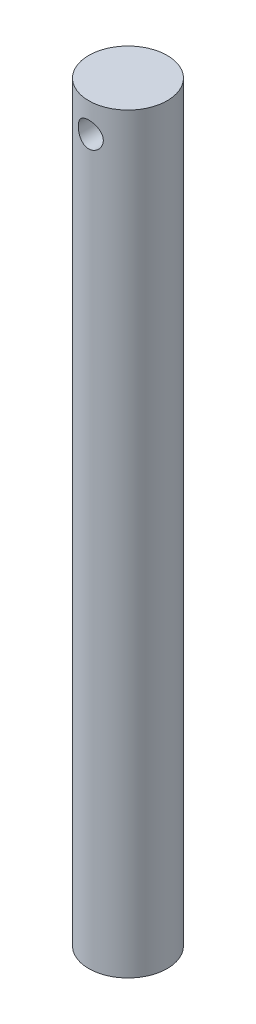
from build123d import *

# Parameters (mm, degrees)
SKETCH1_R               = 9.4
BOSS_EXTRUDE1_DEPTH     = 180
CUT_EXTRUDE1_DEPTH      = 181.490221342
CUT_EXTRUDE1_DEPTH_BACK = 181.490221342
SKETCH2_R               = 3


with BuildPart() as part:
    # Sketch1 → Boss-Extrude1 (new body)
    with BuildSketch(Plane(origin=(0, 0, 0), x_dir=(1, 0, 0), z_dir=(0, 1, 0))):
        with Locations(Location((0, 0, 0), (0, 0, 90))):
            Circle(SKETCH1_R)
    extrude(amount=BOSS_EXTRUDE1_DEPTH)

    # Sketch2 → Cut-Extrude1 (cut, two sides: drawn at the far end of the back side and taken through both)
    with BuildSketch(Plane.XY.offset(-CUT_EXTRUDE1_DEPTH_BACK)):
        with Locations(Location((0, 173, 0), (0, 0, 89.99999999))):
            Circle(SKETCH2_R)
    extrude(amount=CUT_EXTRUDE1_DEPTH + CUT_EXTRUDE1_DEPTH_BACK, mode=Mode.SUBTRACT)


solid = part.part
